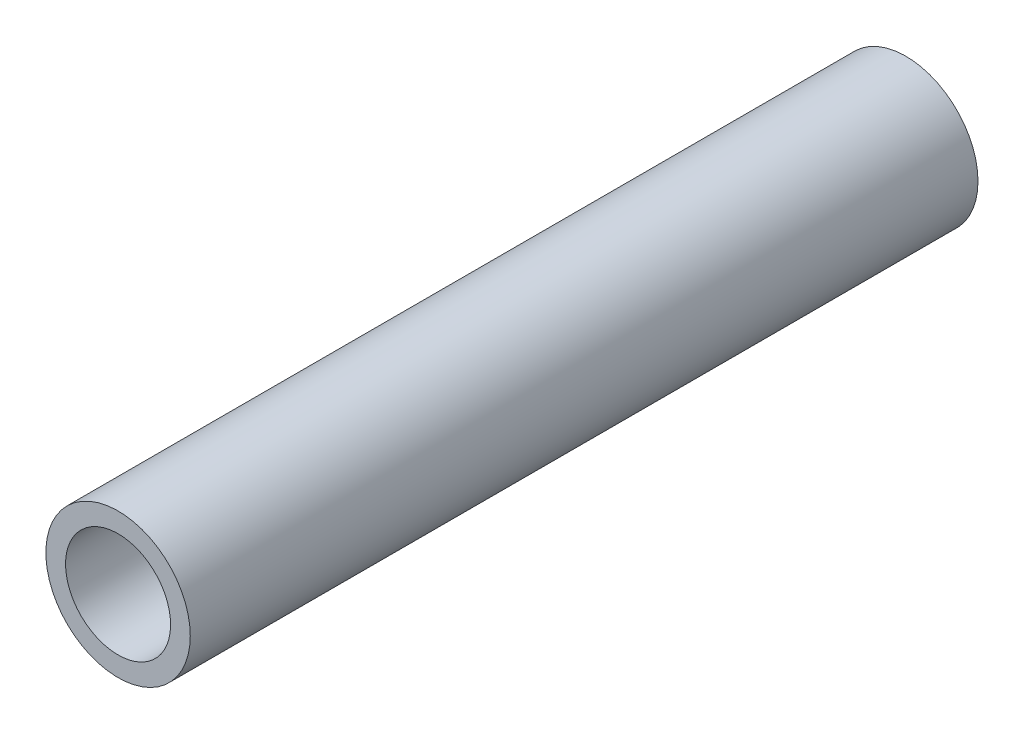
from build123d import *

# Parameters (mm, degrees)
SKETCH1_R           = 11
SKETCH1_R_2         = 8
BOSS_EXTRUDE1_DEPTH = 60


with BuildPart() as part:
    # Sketch1 → Boss-Extrude1 (new, symmetric)
    with BuildSketch(Plane.XY):
        Circle(SKETCH1_R)
        Circle(SKETCH1_R_2, mode=Mode.SUBTRACT)
    extrude(amount=BOSS_EXTRUDE1_DEPTH, both=True)


solid = part.part
